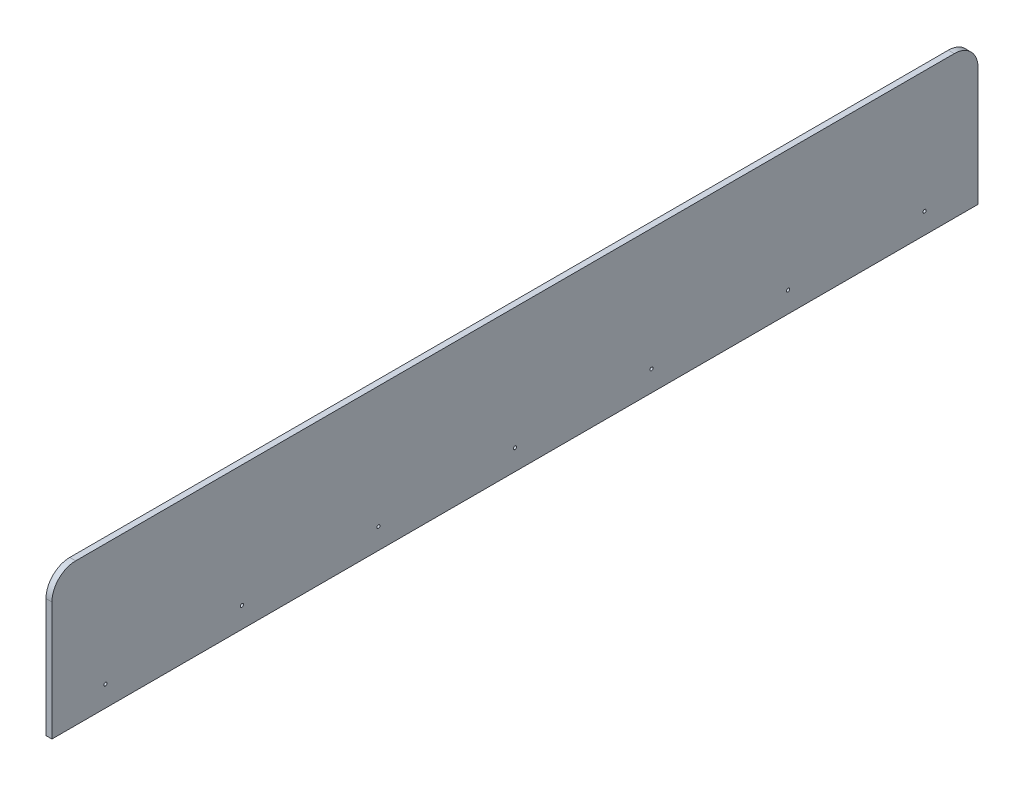
from build123d import *

# Parameters (mm, degrees)
SKETCH1_R           = 3.3734375
BOSS_EXTRUDE1_DEPTH = 12.7


with BuildPart() as part:
    # Sketch1 → Boss-Extrude1 (new body)
    with BuildSketch(Plane(origin=(0, 0, 0), x_dir=(0, 0, -1), z_dir=(1, 0, 0))):
        with BuildLine():
            Line((-990.6, -152.4), (990.6, -152.4))
            Line((990.6, -152.4), (990.6, 101.6))
            ThreePointArc((990.6, 101.6), (975.721024484, 137.521024484), (939.8, 152.4))
            Line((939.8, 152.4), (-939.8, 152.4))
            ThreePointArc((-939.8, 152.4), (-975.721024484, 137.521024484), (-990.6, 101.6))
            Line((-990.6, 101.6), (-990.6, -152.4))
        make_face()
        with Locations((-876.3, -107.95)):
            Circle(SKETCH1_R, mode=Mode.SUBTRACT)
        with Locations((-584.2, -107.95)):
            Circle(SKETCH1_R, mode=Mode.SUBTRACT)
        with Locations((-292.1, -107.95)):
            Circle(SKETCH1_R, mode=Mode.SUBTRACT)
        with Locations((0, -107.95)):
            Circle(SKETCH1_R, mode=Mode.SUBTRACT)
        with Locations((292.1, -107.95)):
            Circle(SKETCH1_R, mode=Mode.SUBTRACT)
        with Locations((584.2, -107.95)):
            Circle(SKETCH1_R, mode=Mode.SUBTRACT)
        with Locations((876.3, -107.95)):
            Circle(SKETCH1_R, mode=Mode.SUBTRACT)
    extrude(amount=BOSS_EXTRUDE1_DEPTH)


solid = part.part
